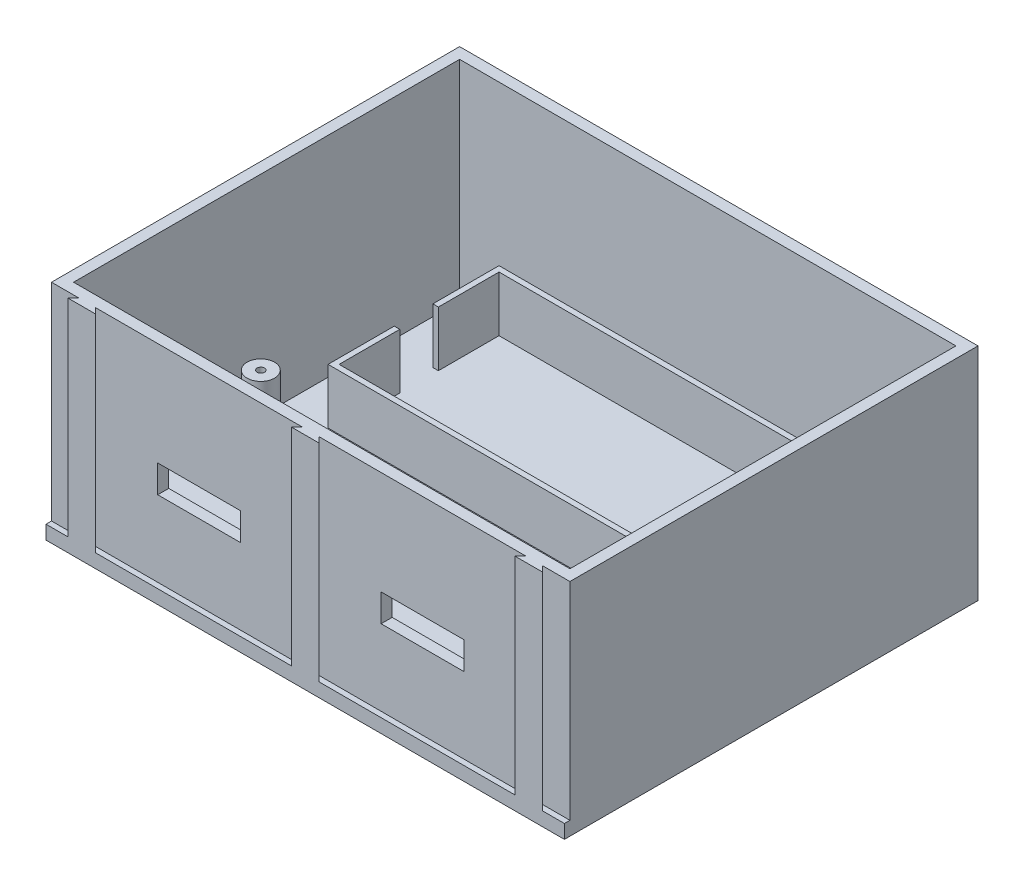
from build123d import *

# Parameters (mm, degrees)
SZKIC1_W                    = 180
SZKIC1_H                    = 140
DODANIE_WYCI_GNI_CIE1_DEPTH = 4
SZKIC6_R                    = 5
SZKIC6_R_2                  = 1.35
DODANIE_WYCI_GNI_CIE2_DEPTH = 20
SZKIC13_W                   = 188
SZKIC13_H                   = 148
SZKIC13_W_2                 = 180
SZKIC13_H_2                 = 140
DODANIE_WYCI_GNI_CIE3_DEPTH = 80
SZKIC14_W                   = 188
SZKIC14_H                   = 5
DODANIE_WYCI_GNI_CIE4_DEPTH = 2
DODANIE_WYCI_GNI_CIE5_DEPTH = 75
WYTNIJ_WYCI_GNI_CIE1_REACH  = 352.281
SZKIC17_W                   = 30
SZKIC17_H                   = 10


with BuildPart() as part:
    # Szkic1 → Dodanie-wyciągnięcie1 (new body)
    with BuildSketch(Plane(origin=(0, 0, 0), x_dir=(-1, 0, 0), z_dir=(0, 1, 0))):
        with Locations((-213.234437894, 908.204921089)):
            Rectangle(SZKIC1_W, SZKIC1_H)
    extrude(amount=DODANIE_WYCI_GNI_CIE1_DEPTH)

    # Szkic6 → Dodanie-wyciągnięcie2 (add)
    # profile 1 of 8: a face of its own
    with BuildSketch(Plane(origin=(0, 4, 0), x_dir=(1, 0, 0), z_dir=(0, 1, 0))):
        with Locations(Location((263.804943957, -915.877316695, 0), (0, 0, 270))):
            Circle(SZKIC6_R)
        with Locations(Location((263.804943957, -915.877316695, 0), (0, 0, 270))):
            Circle(SZKIC6_R_2, mode=Mode.SUBTRACT)
    # profile 2 of 8: a face of its own
    with BuildSketch(Plane(origin=(0, 4, 0), x_dir=(1, 0, 0), z_dir=(0, 1, 0))):
        with Locations(Location((263.804943957, -962.877316695, 0), (0, 0, 270))):
            Circle(SZKIC6_R)
        with Locations(Location((263.804943957, -962.877316695, 0), (0, 0, 270))):
            Circle(SZKIC6_R_2, mode=Mode.SUBTRACT)
    # profile 3 of 8: a face of its own
    with BuildSketch(Plane(origin=(0, 4, 0), x_dir=(1, 0, 0), z_dir=(0, 1, 0))):
        with Locations(Location((128.804943957, -915.877316695, 0), (0, 0, 270))):
            Circle(SZKIC6_R)
        with Locations(Location((128.804943957, -915.877316695, 0), (0, 0, 270))):
            Circle(SZKIC6_R_2, mode=Mode.SUBTRACT)
    # profile 4 of 8: a face of its own
    with BuildSketch(Plane(origin=(0, 4, 0), x_dir=(1, 0, 0), z_dir=(0, 1, 0))):
        with Locations(Location((128.804943957, -962.877316695, 0), (0, 0, 270))):
            Circle(SZKIC6_R)
        with Locations(Location((128.804943957, -962.877316695, 0), (0, 0, 270))):
            Circle(SZKIC6_R_2, mode=Mode.SUBTRACT)
    # profile 5 of 8: a face of its own
    with BuildSketch(Plane(origin=(0, 4, 0), x_dir=(1, 0, 0), z_dir=(0, 1, 0))):
        with Locations(Location((268.102028807, -898.653399162, 0), (0, 0, 270))):
            Circle(SZKIC6_R)
        with Locations(Location((268.102028807, -898.653399162, 0), (0, 0, 270))):
            Circle(SZKIC6_R_2, mode=Mode.SUBTRACT)
    # profile 6 of 8: a face of its own
    with BuildSketch(Plane(origin=(0, 4, 0), x_dir=(1, 0, 0), z_dir=(0, 1, 0))):
        with Locations(Location((295.102028807, -898.653399162, 0), (0, 0, 270))):
            Circle(SZKIC6_R)
        with Locations(Location((295.102028807, -898.653399162, 0), (0, 0, 270))):
            Circle(SZKIC6_R_2, mode=Mode.SUBTRACT)
    # profile 7 of 8: a face of its own
    with BuildSketch(Plane(origin=(0, 4, 0), x_dir=(1, 0, 0), z_dir=(0, 1, 0))):
        Polygon((258.182980941, -864.357234477), (260.182980941, -864.357234477), (260.182980941, -839.857234477), (139.182980941, -839.857234477), (139.182980941, -863.857234467), (141.182980941, -863.857234467), (141.182980941, -841.857234452), (258.182980941, -841.857234452), align=None)
    # profile 8 of 8: a face of its own
    with BuildSketch(Plane(origin=(0, 4, 0), x_dir=(1, 0, 0), z_dir=(0, 1, 0))):
        Polygon((141.182980941, -877.857234487), (141.182980941, -899.857234503), (258.182980941, -899.857234503), (258.182980941, -877.357234477), (260.182980941, -877.357234477), (260.182980941, -901.857234477), (139.182980941, -901.857234477), (139.182980941, -877.857234487), align=None)
    extrude(amount=DODANIE_WYCI_GNI_CIE2_DEPTH)

    # Szkic13 → Dodanie-wyciągnięcie3 (add)
    with BuildSketch(Plane.XZ):
        with Locations((213.234437894, 908.204921089)):
            Rectangle(SZKIC13_W, SZKIC13_H)
        with Locations((213.234437894, 908.204921089)):
            Rectangle(SZKIC13_W_2, SZKIC13_H_2, mode=Mode.SUBTRACT)
    extrude(amount=-DODANIE_WYCI_GNI_CIE3_DEPTH)

    # Szkic14 → Dodanie-wyciągnięcie4 (add)
    with BuildSketch(Plane.XY.offset(982.204921089)):
        with Locations((213.234437894, 2.5)):
            Rectangle(SZKIC14_W, SZKIC14_H)
    extrude(amount=DODANIE_WYCI_GNI_CIE4_DEPTH)

    # Szkic15 → Dodanie-wyciągnięcie5 (add)
    with BuildSketch(Plane(origin=(0, 5, 0), x_dir=(1, 0, 0), z_dir=(0, 1, 0))):
        Polygon((299.287557022, -984.204921089), (297.234437894, -982.204921089), (291.287557022, -982.204921089), (289.287557022, -984.204921089), align=None)
        Polygon((135.234437894, -982.204921089), (129.234437894, -982.204921089), (127.234437894, -984.204921089), (137.234437894, -984.204921089), align=None)
        Polygon((208.260997458, -984.204921089), (218.260997458, -984.204921089), (216.260997458, -982.204921089), (210.260997458, -982.204921089), align=None)
    extrude(amount=DODANIE_WYCI_GNI_CIE5_DEPTH)

    # Szkic17 → Wytnij-wyciągnięcie1 (cut, up to next)
    with BuildSketch(Plane.XY.offset(982.204921089), mode=Mode.PRIVATE) as wytnij_wyci_gni_cie1_sk1:
        with Locations((253.77427724, 37.5)):
            Rectangle(SZKIC17_W, SZKIC17_H)
    wytnij_wyci_gni_cie1_tool1 = extrude(wytnij_wyci_gni_cie1_sk1.sketch, amount=-WYTNIJ_WYCI_GNI_CIE1_REACH, mode=Mode.PRIVATE) & part.part
    # Szkic17 → Wytnij-wyciągnięcie1 (cut, up to next)
    with BuildSketch(Plane.XY.offset(982.204921089), mode=Mode.PRIVATE) as wytnij_wyci_gni_cie1_sk2:
        with Locations((172.747717676, 37.5)):
            Rectangle(SZKIC17_W, SZKIC17_H)
    wytnij_wyci_gni_cie1_tool2 = extrude(wytnij_wyci_gni_cie1_sk2.sketch, amount=-WYTNIJ_WYCI_GNI_CIE1_REACH, mode=Mode.PRIVATE) & part.part
    add(wytnij_wyci_gni_cie1_tool1.solids().sort_by_distance((253.774277, 37.5, 982.204921))[0], mode=Mode.SUBTRACT)
    add(wytnij_wyci_gni_cie1_tool2.solids().sort_by_distance((172.747718, 37.5, 982.204921))[0], mode=Mode.SUBTRACT)


solid = part.part
